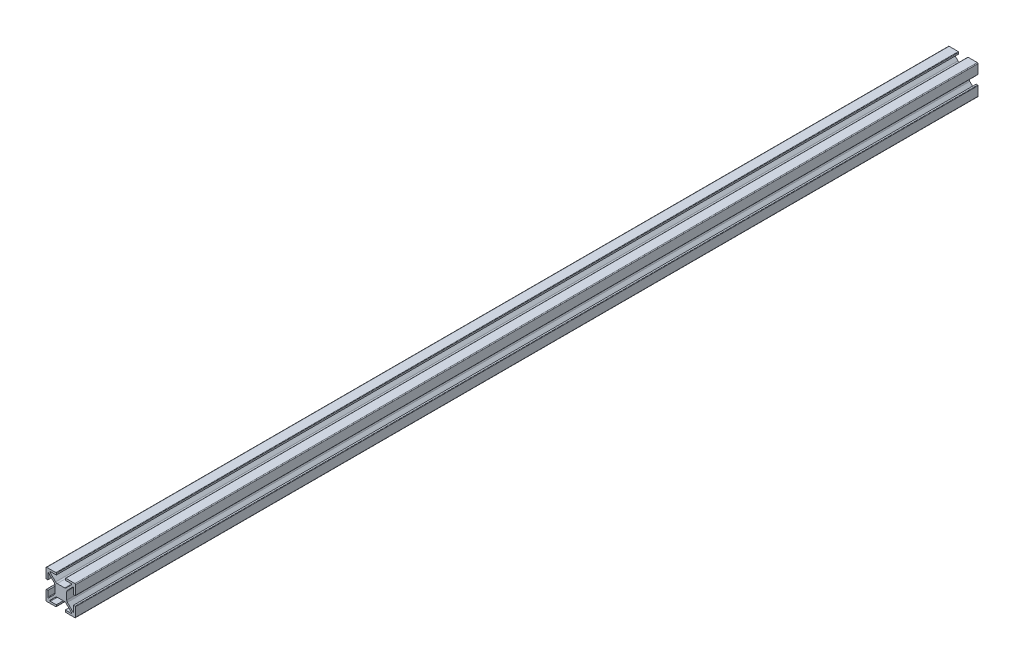
from build123d import *

# Parameters (mm, degrees)
BOSS_EXTRUDE1_DEPTH = 610


with BuildPart() as part:
    # Sketch1 → Boss-Extrude1 (new body)
    with BuildSketch(Plane.XY):
        with BuildLine():
            Line((-9.676936556, -5.886265937), (-13.425464694, -2.1377378))
            ThreePointArc((-13.425464694, -2.1377378), (-13.750623821, -1.651102776), (-13.864804522, -1.077077628))
            Line((-13.864804522, -1.077077628), (-13.864804522, 3.841804054))
            ThreePointArc((-13.864804522, 3.841804054), (-13.750623821, 4.415829202), (-13.425464694, 4.902464226))
            Line((-13.425464694, 4.902464226), (-9.676936556, 8.650992363))
            ThreePointArc((-9.676936556, 8.650992363), (-9.349999492, 8.716024189), (-9.164804522, 8.438860329))
            Line((-9.164804522, 8.438860329), (-9.164804522, 4.432363213))
            Line((-9.164804522, 4.432363213), (-8.164804522, 4.432363213))
            ThreePointArc((-8.164804522, 4.432363213), (-7.952672488, 4.520231179), (-7.864804522, 4.732363213))
            Line((-7.864804522, 4.732363213), (-7.864804522, 10.882363213))
            ThreePointArc((-7.864804522, 10.882363213), (-8.011251131, 11.235916604), (-8.364804522, 11.382363213))
            Line((-8.364804522, 11.382363213), (-14.514804522, 11.382363213))
            ThreePointArc((-14.514804522, 11.382363213), (-14.726936556, 11.294495247), (-14.814804522, 11.082363213))
            Line((-14.814804522, 11.082363213), (-14.814804522, 10.082363213))
            Line((-14.814804522, 10.082363213), (-10.808307406, 10.082363213))
            ThreePointArc((-10.808307406, 10.082363213), (-10.531143546, 9.897168243), (-10.596175372, 9.570231179))
            Line((-10.596175372, 9.570231179), (-14.344703509, 5.821703041))
            ThreePointArc((-14.344703509, 5.821703041), (-14.831338532, 5.496543914), (-15.405363681, 5.382363213))
            Line((-15.405363681, 5.382363213), (-20.324245363, 5.382363213))
            ThreePointArc((-20.324245363, 5.382363213), (-20.898270511, 5.496543914), (-21.384905535, 5.821703041))
            Line((-21.384905535, 5.821703041), (-25.133433672, 9.570231179))
            ThreePointArc((-25.133433672, 9.570231179), (-25.198465497, 9.897168243), (-24.921301638, 10.082363213))
            Line((-24.921301638, 10.082363213), (-20.914804522, 10.082363213))
            Line((-20.914804522, 10.082363213), (-20.914804522, 11.082363213))
            ThreePointArc((-20.914804522, 11.082363213), (-21.002672488, 11.294495247), (-21.214804522, 11.382363213))
            Line((-21.214804522, 11.382363213), (-27.364804522, 11.382363213))
            ThreePointArc((-27.364804522, 11.382363213), (-27.718357912, 11.235916604), (-27.864804522, 10.882363213))
            Line((-27.864804522, 10.882363213), (-27.864804522, 4.732363213))
            ThreePointArc((-27.864804522, 4.732363213), (-27.776936556, 4.520231179), (-27.564804522, 4.432363213))
            Line((-27.564804522, 4.432363213), (-26.564804522, 4.432363213))
            Line((-26.564804522, 4.432363213), (-26.564804522, 8.438860329))
            ThreePointArc((-26.564804522, 8.438860329), (-26.379609552, 8.716024189), (-26.052672488, 8.650992363))
            Line((-26.052672488, 8.650992363), (-22.30414435, 4.902464226))
            ThreePointArc((-22.30414435, 4.902464226), (-21.978985223, 4.415829202), (-21.864804522, 3.841804054))
            Line((-21.864804522, 3.841804054), (-21.864804522, -1.077077628))
            ThreePointArc((-21.864804522, -1.077077628), (-21.978985223, -1.651102776), (-22.30414435, -2.1377378))
            Line((-22.30414435, -2.1377378), (-26.052672488, -5.886265937))
            ThreePointArc((-26.052672488, -5.886265937), (-26.379609552, -5.951297762), (-26.564804522, -5.674133903))
            Line((-26.564804522, -5.674133903), (-26.564804522, -1.667636787))
            Line((-26.564804522, -1.667636787), (-27.564804522, -1.667636787))
            ThreePointArc((-27.564804522, -1.667636787), (-27.776936556, -1.755504753), (-27.864804522, -1.967636787))
            Line((-27.864804522, -1.967636787), (-27.864804522, -8.117636787))
            ThreePointArc((-27.864804522, -8.117636787), (-27.718357912, -8.471190178), (-27.364804522, -8.617636787))
            Line((-27.364804522, -8.617636787), (-21.214804522, -8.617636787))
            ThreePointArc((-21.214804522, -8.617636787), (-21.002672488, -8.529768821), (-20.914804522, -8.317636787))
            Line((-20.914804522, -8.317636787), (-20.914804522, -7.317636787))
            Line((-20.914804522, -7.317636787), (-24.921301638, -7.317636787))
            ThreePointArc((-24.921301638, -7.317636787), (-25.198465497, -7.132441817), (-25.133433672, -6.805504753))
            Line((-25.133433672, -6.805504753), (-21.384905535, -3.056976615))
            ThreePointArc((-21.384905535, -3.056976615), (-20.898270511, -2.731817488), (-20.324245363, -2.617636787))
            Line((-20.324245363, -2.617636787), (-15.405363681, -2.617636787))
            ThreePointArc((-15.405363681, -2.617636787), (-14.831338532, -2.731817488), (-14.344703509, -3.056976615))
            Line((-14.344703509, -3.056976615), (-10.596175372, -6.805504753))
            ThreePointArc((-10.596175372, -6.805504753), (-10.531143546, -7.132441817), (-10.808307406, -7.317636787))
            Line((-10.808307406, -7.317636787), (-14.814804522, -7.317636787))
            Line((-14.814804522, -7.317636787), (-14.814804522, -8.317636787))
            ThreePointArc((-14.814804522, -8.317636787), (-14.726936556, -8.529768821), (-14.514804522, -8.617636787))
            Line((-14.514804522, -8.617636787), (-8.364804522, -8.617636787))
            ThreePointArc((-8.364804522, -8.617636787), (-8.011251131, -8.471190178), (-7.864804522, -8.117636787))
            Line((-7.864804522, -8.117636787), (-7.864804522, -1.967636787))
            ThreePointArc((-7.864804522, -1.967636787), (-7.952672488, -1.755504753), (-8.164804522, -1.667636787))
            Line((-8.164804522, -1.667636787), (-9.164804522, -1.667636787))
            Line((-9.164804522, -1.667636787), (-9.164804522, -5.674133903))
            ThreePointArc((-9.164804522, -5.674133903), (-9.349999492, -5.951297762), (-9.676936556, -5.886265937))
        make_face()
    extrude(amount=BOSS_EXTRUDE1_DEPTH)


solid = part.part
